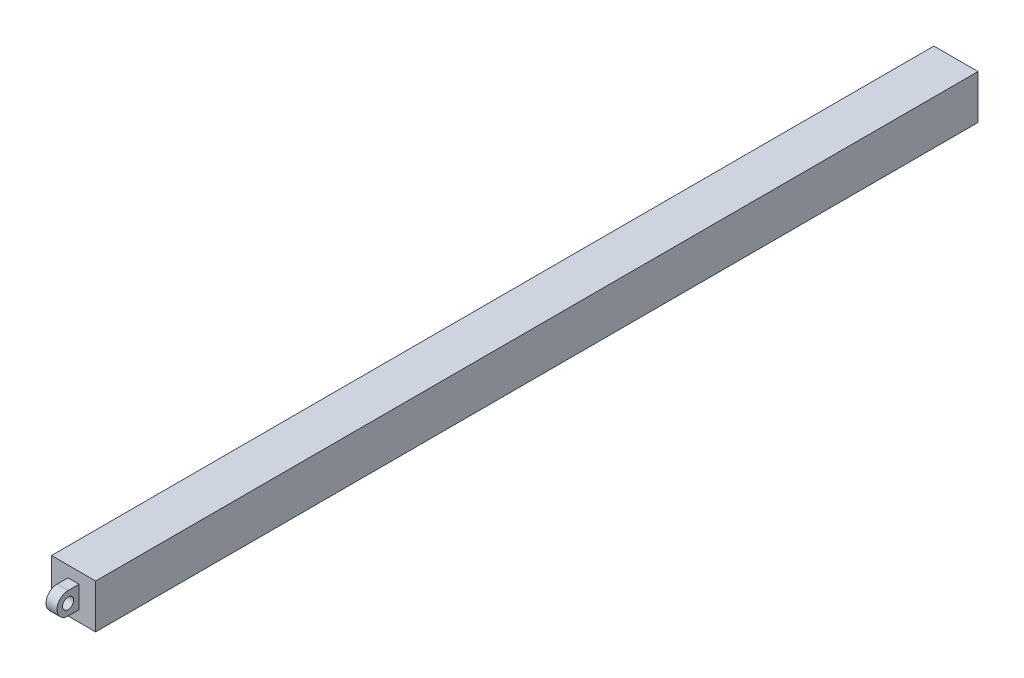
from build123d import *

# Parameters (mm, degrees)
SKETCH_2_W      = 200
SKETCH_2_H      = 10
EXTRUDE_1_DEPTH = 5
SKETCH_3_R      = 1.25
EXTRUDE_2_DEPTH = 1.25


with BuildPart() as part:
    # 스케치2 → 보스-돌출1 (new, symmetric)
    with BuildSketch(Plane(origin=(0, 0, 0), x_dir=(0, 0, -1), z_dir=(1, 0, 0))):
        Rectangle(SKETCH_2_W, SKETCH_2_H)
    extrude(amount=EXTRUDE_1_DEPTH, both=True)

    # 스케치3 → 보스-돌출2 (add, symmetric)
    with BuildSketch(Plane(origin=(0, 0, 0), x_dir=(0, 0, -1), z_dir=(1, 0, 0))):
        with BuildLine():
            Line((-102.5, 2.5), (-100, 2.5))
            Line((-100, 2.5), (-100, -2.5))
            Line((-100, -2.5), (-102.5, -2.5))
            ThreePointArc((-102.5, -2.5), (-105, 0), (-102.5, 2.5))
        make_face()
        with Locations((-102.5, 0)):
            Circle(SKETCH_3_R, mode=Mode.SUBTRACT)
    extrude(amount=EXTRUDE_2_DEPTH, both=True)


solid = part.part
